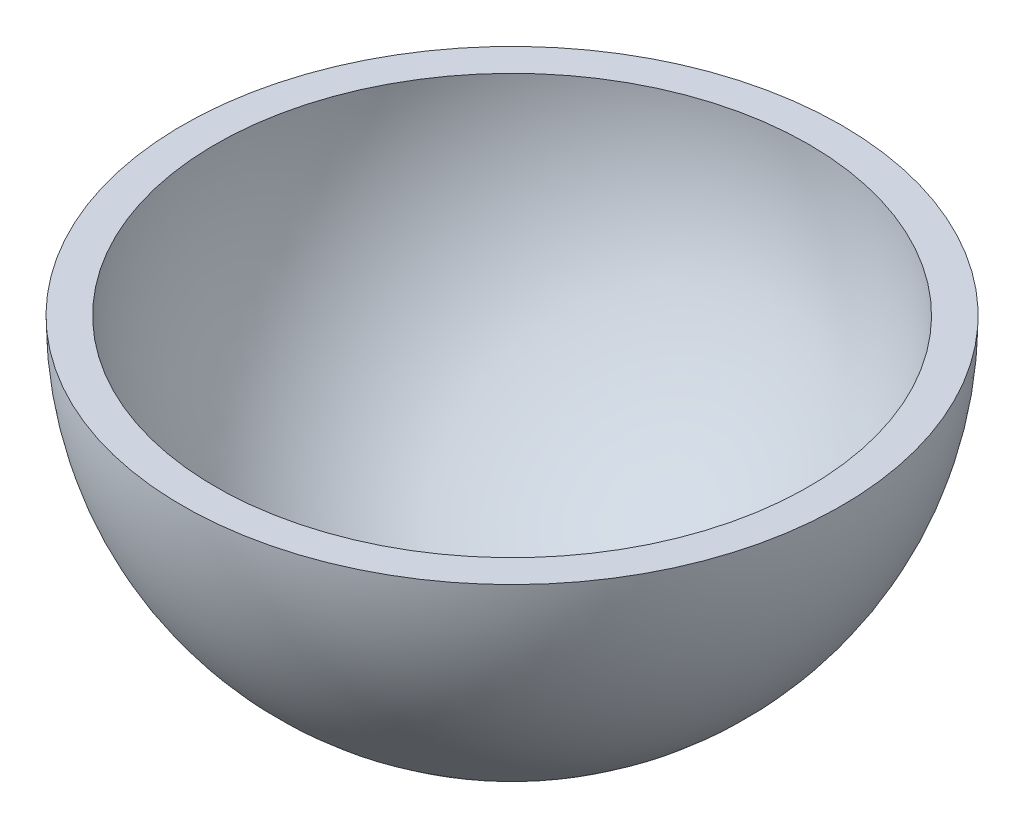
from build123d import *

# Parameters (mm, degrees)
REVOLVE_1_ANGLE = 180


with BuildPart() as part:
    # 草图1 → 旋转1 (revolve)
    with BuildSketch(Plane(origin=(0, 0, 0), x_dir=(1, 0, 0), z_dir=(0, 1, 0))):
        with BuildLine():
            Line((-25, 0), (-22.5, 0))
            ThreePointArc((-22.5, 0), (0, 22.5), (22.5, 0))
            Line((22.5, 0), (25, 0))
            ThreePointArc((25, 0), (0, 25), (-25, 0))
        make_face()
    revolve(axis=Axis((25, 0, 0), (-1, 0, 0)), revolution_arc=REVOLVE_1_ANGLE)


solid = part.part
